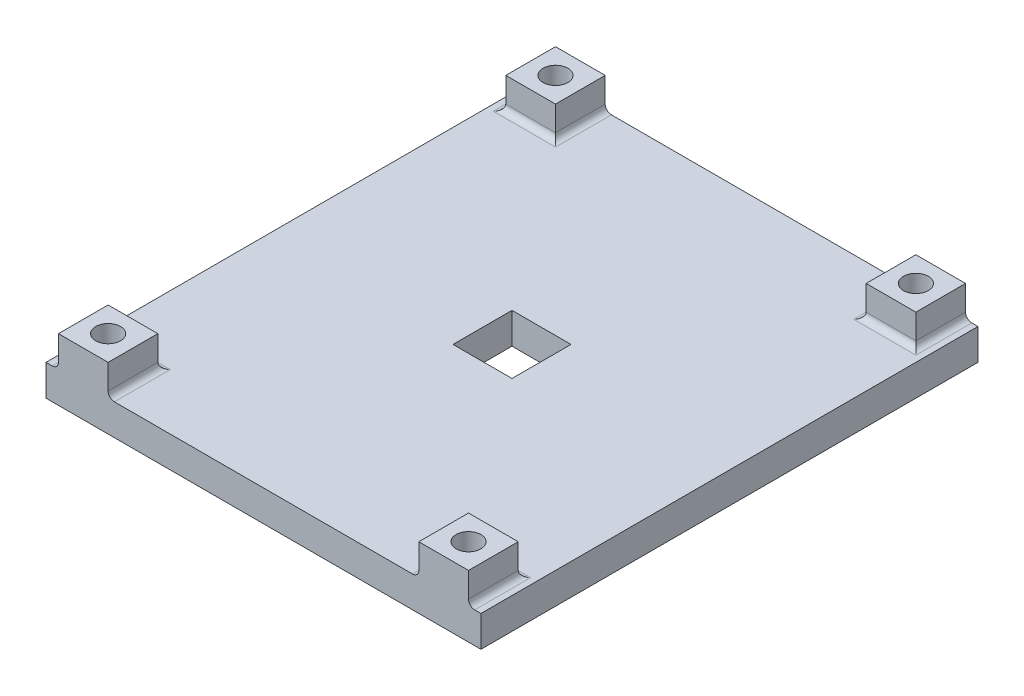
from build123d import *

# Parameters (mm, degrees)
SKETCH_1_W          = 70
SKETCH_1_H          = 80
EXTRUDE_1_DEPTH     = 5
SKETCH_3_W          = 8
SKETCH_3_H          = 8
EXTRUDE_3_DEPTH     = 5
SKETCH_12_R         = 2
SKETCH_12_W         = 9.5
SKETCH_12_H         = 9.5
CUT_EXTRUDE_2_DEPTH = 10
FILLET_1_R          = 1


with BuildPart() as part:
    # 草圖1 → 填料-伸長1 (new body)
    with BuildSketch(Plane(origin=(0, 0, 0), x_dir=(1, 0, 0), z_dir=(0, 1, 0))):
        Rectangle(SKETCH_1_W, SKETCH_1_H)
    extrude(amount=EXTRUDE_1_DEPTH)

    # 草圖3 → 填料-伸長3 (add)
    with BuildSketch(Plane(origin=(0, 5, 0), x_dir=(1, 0, 0), z_dir=(0, 1, 0))):
        with Locations((-29, -36)):
            Rectangle(SKETCH_3_W, SKETCH_3_H)
        with Locations((-29, 36)):
            Rectangle(SKETCH_3_W, SKETCH_3_H)
        with Locations((29, -36)):
            Rectangle(SKETCH_3_W, SKETCH_3_H)
        with Locations((29, 36)):
            Rectangle(SKETCH_3_W, SKETCH_3_H)
    extrude(amount=EXTRUDE_3_DEPTH)

    # 草圖12 → 除料-伸長2 (cut)
    with BuildSketch(Plane(origin=(0, 10, 0), x_dir=(1, 0, 0), z_dir=(0, 1, 0))):
        with Locations(Location((-29, 36, 0), (0, 0, 270))):
            Circle(SKETCH_12_R)
        with Locations(Location((-29, -36, 0), (0, 0, 90))):
            Circle(SKETCH_12_R)
        with Locations(Location((29, -36, 0), (0, 0, 270))):
            Circle(SKETCH_12_R)
        with Locations(Location((29, 36, 0), (0, 0, 90))):
            Circle(SKETCH_12_R)
        Rectangle(SKETCH_12_W, SKETCH_12_H)
    extrude(amount=-CUT_EXTRUDE_2_DEPTH, mode=Mode.SUBTRACT)

    # 圓角1
    fillet_1_edges = [part.edges().sort_by_distance(p)[0] for p in [
        (-33, 5, 36),
        (-25, 5, 36),
        (-29, 5, 32),
        (-33, 5, -36),
        (-29, 5, -32),
        (-25, 5, -36),
        (33, 5, 36),
        (29, 5, 32),
        (25, 5, 36),
        (33, 5, -36),
        (25, 5, -36),
        (29, 5, -32),
    ]]
    fillet(fillet_1_edges, radius=FILLET_1_R)


solid = part.part
